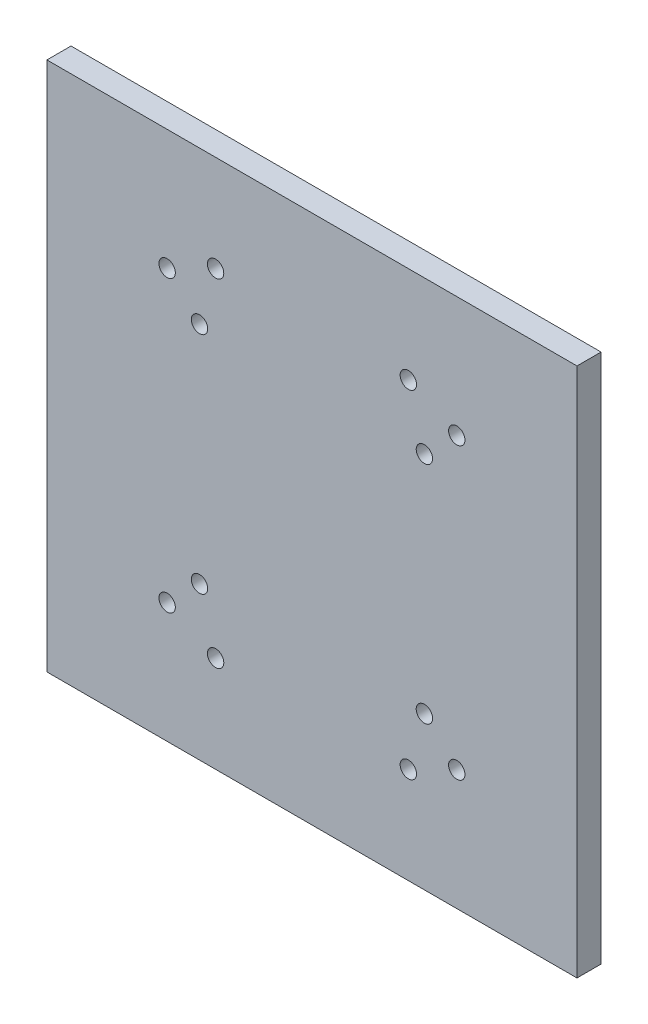
from build123d import *

# Parameters (mm, degrees)
SKIZZE1_W                       = 220
SKIZZE1_H                       = 220
AUFSATZ_LINEAR_AUSTRAGEN1_DEPTH = 10
SKIZZE2_R                       = 3.4
SCHNITT_LINEAR_AUSTRAGEN1_DEPTH = 156.884572681
SKIZZE3_R                       = 3.4
SCHNITT_LINEAR_AUSTRAGEN2_DEPTH = 156.884572681


with BuildPart() as part:
    # Skizze1 → Aufsatz-Linear austragen1 (new body)
    with BuildSketch(Plane.XY):
        Rectangle(SKIZZE1_W, SKIZZE1_H)
    extrude(amount=AUFSATZ_LINEAR_AUSTRAGEN1_DEPTH)

    # Skizze2 → Schnitt-Linear austragen1 (cut, through all)
    with BuildSketch(Plane.XY.offset(10)):
        with Locations((46.669047558, 46.669047558)):
            Circle(SKIZZE2_R)
        with Locations((46.669047558, -46.669047558)):
            Circle(SKIZZE2_R)
        with Locations((-46.669047558, -46.669047558)):
            Circle(SKIZZE2_R)
        with Locations((-46.669047558, 46.669047558)):
            Circle(SKIZZE2_R)
        with Locations((60.104076401, 60.104076401)):
            Circle(SKIZZE2_R)
        with Locations((60.104076401, -60.104076401)):
            Circle(SKIZZE2_R)
        with Locations((-60.104076401, -60.104076401)):
            Circle(SKIZZE2_R)
        with Locations((-60.104076401, 60.104076401)):
            Circle(SKIZZE2_R)
    extrude(amount=-SCHNITT_LINEAR_AUSTRAGEN1_DEPTH, mode=Mode.SUBTRACT)

    # Skizze3 → Schnitt-Linear austragen2 (cut, through all)
    with BuildSketch(Plane.XY.offset(10)):
        with Locations((40, -70)):
            Circle(SKIZZE3_R)
        with Locations((-40, -70)):
            Circle(SKIZZE3_R)
        with Locations((40, 70)):
            Circle(SKIZZE3_R)
        with Locations((-40, 70)):
            Circle(SKIZZE3_R)
    extrude(amount=-SCHNITT_LINEAR_AUSTRAGEN2_DEPTH, mode=Mode.SUBTRACT)


solid = part.part
